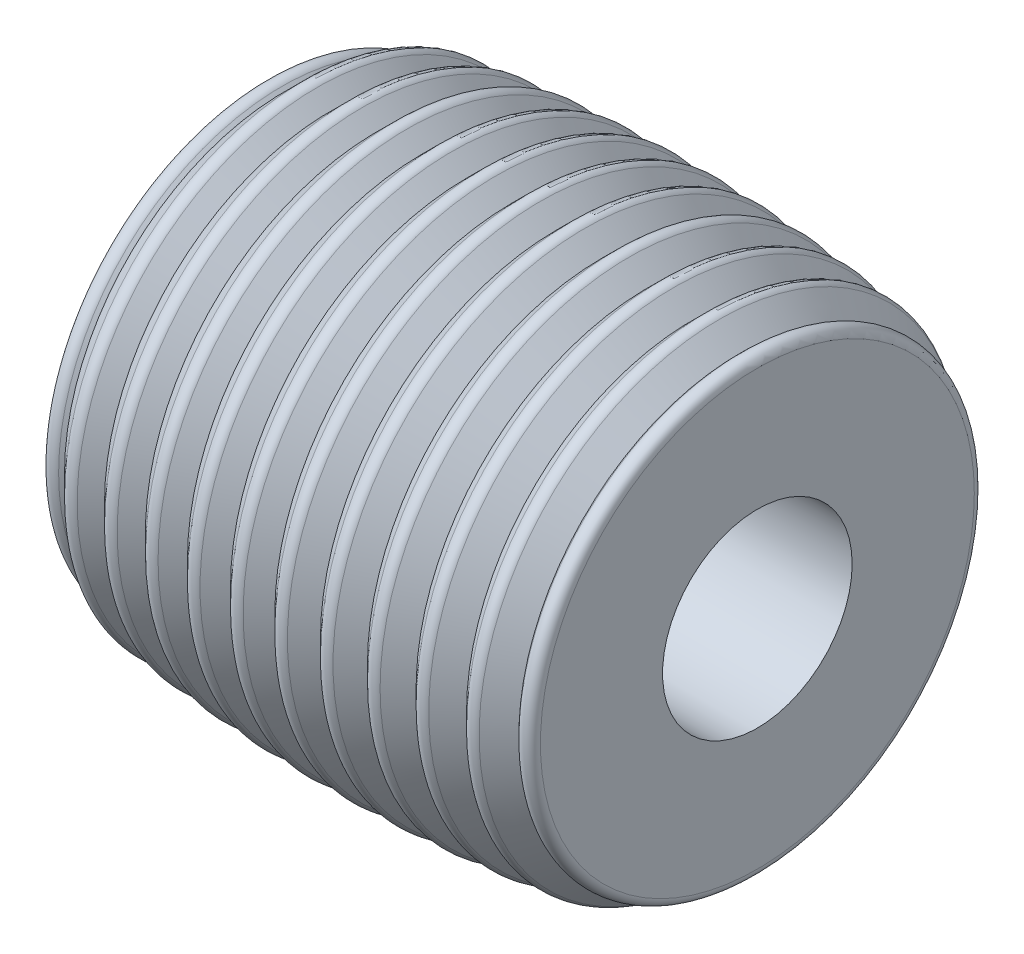
from build123d import *

# Parameters (mm, degrees)
SKETCH2_R           = 4.875
BOSS_EXTRUDE1_DEPTH = 5.5
CUT_EXTRUDE1_REACH  = 15.733
SKETCH4_R           = 2.125
FILLET1_R           = 0.2


with BuildPart() as part:
    # Sketch2 → Boss-Extrude1 (new, symmetric)
    with BuildSketch(Plane(origin=(0, 0, 0), x_dir=(0, 0, -1), z_dir=(1, 0, 0))):
        Circle(SKETCH2_R)
    extrude(amount=BOSS_EXTRUDE1_DEPTH, both=True)

    # Sketch5 → Revolve1 (revolve)
    with BuildSketch(Plane(origin=(0, 0, 0), x_dir=(1, 0, 0), z_dir=(0, 1, 0))):
        Polygon((-5.5, 5.346108171), (-5.5, 4.875), (5.5, 4.875), (5.5, 5.346108171), (5.09237885, 4.938487021), (4.50544745, 5.52541842), (4.057352754, 5.077323724), (3.492454889, 5.642221589), (3.033601359, 5.18336806), (2.488427486, 5.728541933), (2.018000809, 5.258115256), (1.490618706, 5.785497359), (1.007696347, 5.302575), (0.49647007, 5.813801276), (0, 5.317331206), (-0.49647007, 5.813801276), (-1.007696347, 5.302575), (-1.490618706, 5.785497359), (-2.018000809, 5.258115256), (-2.488427486, 5.728541933), (-3.033601359, 5.18336806), (-3.492454889, 5.642221589), (-4.057352754, 5.077323724), (-4.50544745, 5.52541842), (-5.09237885, 4.938487021), align=None)
    revolve(axis=Axis((5.5, 0, 0), (-1, 0, 0)))

    # Sketch4 → Cut-Extrude1 (cut, up to next)
    with BuildSketch(Plane(origin=(5.5, 0, 0), x_dir=(0, 0, -1), z_dir=(1, 0, 0)), mode=Mode.PRIVATE) as cut_extrude1_sk1:
        Circle(SKETCH4_R)
    cut_extrude1_tool1 = extrude(cut_extrude1_sk1.sketch, amount=-CUT_EXTRUDE1_REACH, mode=Mode.PRIVATE) & part.part
    add(cut_extrude1_tool1.solids().sort_by_distance((5.5, 0, 0))[0], mode=Mode.SUBTRACT)

    # Fillet1
    fillet1_edges = [part.edges().sort_by_distance(p)[0] for p in [
        (5.5, 0, 5.346108171),
        (4.50544745, 0, 5.52541842),
        (3.492454889, 0, 5.642221589),
        (2.488427486, 0, 5.728541933),
        (1.490618706, 0, 5.785497359),
        (0.49647007, 0, 5.813801276),
        (-0.49647007, 0, 5.813801276),
        (-1.490618706, 0, 5.785497359),
        (-2.488427486, 0, 5.728541933),
        (-3.492454889, 0, 5.642221589),
        (-4.50544745, 0, 5.52541842),
        (-5.5, 0, 5.346108171),
    ]]
    fillet(fillet1_edges, radius=FILLET1_R)


solid = part.part
